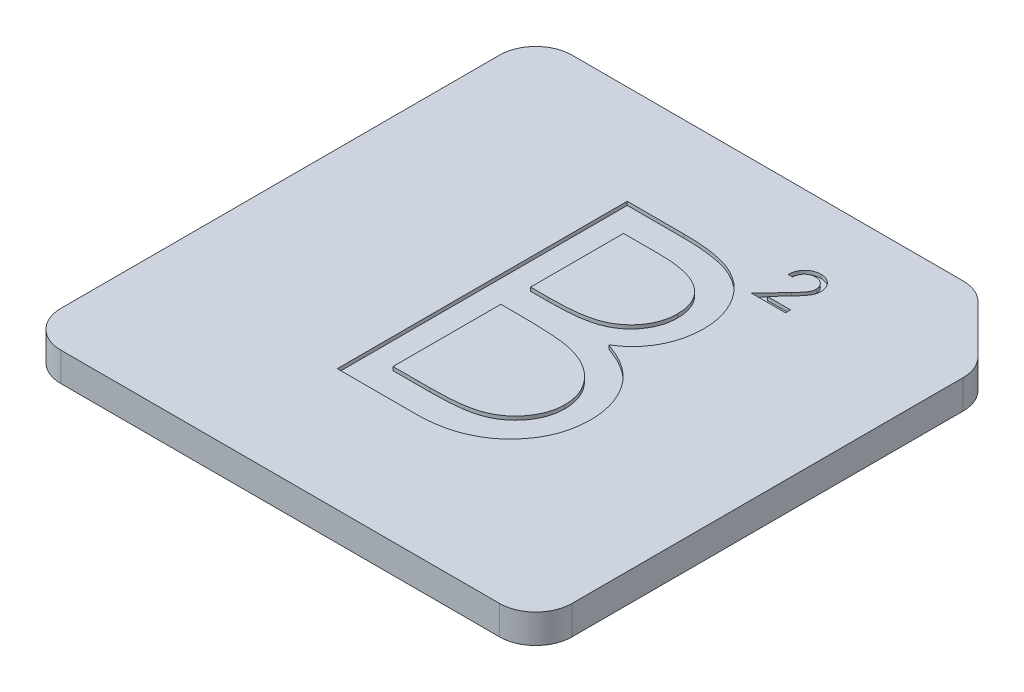
from build123d import *

# Parameters (mm, degrees)
BOSS_EXTRUDE1_DEPTH = 4
FILLET1_R           = 5
FILLET5_R           = 5
FILLET6_R           = 5
FILLET7_R           = 5
CUT_EXTRUDE1_DEPTH  = 0.5
CUT_EXTRUDE2_DEPTH  = 0.5
SKETCH5_R           = 3.25
CUT_EXTRUDE3_DEPTH  = 2.5


with BuildPart() as part:
    # Sketch1 → Boss-Extrude1 (new body)
    with BuildSketch(Plane(origin=(0, 0, 0), x_dir=(1, 0, 0), z_dir=(0, 1, 0))):
        Polygon((25.75, 35.25), (35.25, 25.75), (35.25, -35.25), (-35.25, -35.25), (-35.25, 35.25), align=None)
    extrude(amount=BOSS_EXTRUDE1_DEPTH)

    # Fillet1
    fillet1_edges = [part.edges().sort_by_distance(p)[0] for p in [
        (-35.25, 2, 35.25),
    ]]
    fillet(fillet1_edges, radius=FILLET1_R)

    # Fillet5
    fillet5_edges = [part.edges().sort_by_distance(p)[0] for p in [
        (35.25, 2, 35.25),
    ]]
    fillet(fillet5_edges, radius=FILLET5_R)

    # Fillet6
    fillet6_edges = [part.edges().sort_by_distance(p)[0] for p in [
        (-35.25, 2, -35.25),
    ]]
    fillet(fillet6_edges, radius=FILLET6_R)

    # Fillet7
    fillet7_edges = [part.edges().sort_by_distance(p)[0] for p in [
        (25.75, 2, -35.25),
        (35.25, 2, -25.75),
    ]]
    fillet(fillet7_edges, radius=FILLET7_R)

    # Sketch3 → Cut-Extrude1 (cut)
    with BuildSketch(Plane(origin=(0, 4, 0), x_dir=(1, 0, 0), z_dir=(0, 1, 0))):
        with BuildLine():
            Line((-8.984851083, 21.600223812), (-1.180363904, 21.600223812))
            add(Edge.make_bspline(
                [(-1.180363904, 21.600223812), (-0.798324153, 21.598215236), (-0.057836035, 21.594322116), (1.018957586, 21.533943474), (2.027515422, 21.451615818), (2.968129963, 21.320986188), (3.840366562, 21.163365878), (4.646853845, 20.97248798), (5.385027242, 20.743612395), (6.266315658, 20.379654895), (7.271123211, 19.838818685), (8.359104842, 19.039635084), (9.289439006, 18.062121219), (10.091568346, 16.9594623), (10.729295427, 15.746482052), (11.190658825, 14.452091323), (11.482748829, 13.092985701), (11.512788077, 12.159920811), (11.52796943, 11.688364838)],
                knots=[0, 0, 0, 0, 1.001505555, 1.941167018, 2.826882275, 3.653841531, 4.429895133, 5.150066043, 5.825578002, 6.45369114, 7.647487171, 8.808567382, 9.977351308, 11.170798116, 12.373658725, 13.556498008, 14.765093433, 16, 16, 16, 16], degree=3))
            add(Edge.make_bspline(
                [(11.52796943, 11.688364838), (11.515475505, 11.246621344), (11.490923764, 10.378553721), (11.256149371, 9.108906758), (10.888598875, 7.9003214), (10.377681741, 6.757208424), (9.713658928, 5.705395702), (8.926706714, 4.736398376), (7.977257543, 3.891243439), (7.265906229, 3.418753124), (6.904571994, 3.178749453)],
                knots=[0, 0, 0, 0, 1.044552857, 2.05264487, 3.044412934, 4.028983338, 5.005914585, 5.980388656, 6.974128949, 8, 8, 8, 8], degree=3))
            add(Edge.make_bspline(
                [(6.904571994, 3.178749453), (7.358976881, 3.004292322), (8.228365993, 2.670512615), (9.424777564, 2.080393026), (10.455575793, 1.438540336), (11.328686032, 0.737604906), (12.075402089, -0.01792436), (12.727435707, -0.839125666), (13.283794268, -1.73671147), (13.760513395, -2.701323303), (14.132499178, -3.723111513), (14.411080942, -4.792491811), (14.570708932, -5.905629585), (14.593424833, -6.663176777), (14.604892507, -7.045609521)],
                knots=[0, 0, 0, 0, 1.27268992, 2.434971085, 3.483601985, 4.442670788, 5.356604649, 6.2567628, 7.179492994, 8.113709626, 9.066344395, 10.018646069, 10.999752585, 12, 12, 12, 12], degree=3))
            add(Edge.make_bspline(
                [(14.604892507, -7.045609521), (14.593728552, -7.43608806), (14.571763159, -8.204365524), (14.409706338, -9.332995633), (14.135316544, -10.411566452), (13.757360585, -11.447054254), (13.26407699, -12.437455791), (12.663757398, -13.383893093), (11.947968099, -14.276856872), (11.147249597, -15.126269707), (10.241396506, -15.890015848), (9.264073592, -16.570195353), (8.202972793, -17.12957892), (7.075521433, -17.599476309), (5.869072106, -17.95841572), (4.589042308, -18.20953085), (3.236536001, -18.378731273), (2.30842456, -18.392642186), (1.832456609, -18.399776188)],
                knots=[0, 0, 0, 0, 0.978564426, 1.925352924, 2.850884081, 3.763762016, 4.682927383, 5.618979971, 6.567305752, 7.547517671, 8.540179244, 9.531824382, 10.526200242, 11.540722885, 12.589160233, 13.674978461, 14.80764778, 16, 16, 16, 16], degree=3))
            Line((1.832456609, -18.399776188), (-8.984851083, -18.399776188))
            Line((-8.984851083, -18.399776188), (-8.984851083, 21.600223812))
        make_face()
        with BuildLine():
            Line((-5.395107493, 17.497659709), (-5.395107493, 4.677146889))
            Line((-5.395107493, 4.677146889), (-2.983248519, 4.677146889))
            add(Edge.make_bspline(
                [(-2.983248519, 4.677146889), (-2.630690858, 4.681717437), (-1.949477609, 4.690548669), (-0.962964506, 4.715846007), (-0.047250012, 4.786680789), (0.796085223, 4.857495212), (1.565713154, 4.972633357), (2.259928714, 5.10968619), (2.889626965, 5.254633677), (3.6157932, 5.501142099), (4.439484039, 5.865458386), (5.317576658, 6.430850799), (6.091684882, 7.104271979), (6.745367027, 7.881311542), (7.280355262, 8.736925094), (7.651940578, 9.657460871), (7.90390954, 10.619976665), (7.926669898, 11.280756697), (7.93822584, 11.616249453)],
                knots=[0, 0, 0, 0, 1.156816544, 2.235205308, 3.236616184, 4.169592532, 5.011045266, 5.787822928, 6.49130361, 7.128639758, 8.301311294, 9.436451833, 10.541879658, 11.654887649, 12.756523258, 13.837046038, 14.901820046, 16, 16, 16, 16], degree=3))
            add(Edge.make_bspline(
                [(7.93822584, 11.616249453), (7.932212352, 11.83825827), (7.920416239, 12.273752809), (7.823807066, 12.90860257), (7.659606216, 13.505674028), (7.448700007, 14.073149574), (7.153972136, 14.593285005), (6.806961127, 15.084064385), (6.387696095, 15.52877431), (5.910469665, 15.94442572), (5.361799689, 16.312934609), (4.742013497, 16.635686188), (4.042725759, 16.895580778), (3.275721702, 17.12319395), (2.429194988, 17.283060165), (1.512914378, 17.416241738), (0.519374732, 17.484044504), (-0.167997869, 17.493020079), (-0.523312622, 17.497659709)],
                knots=[0, 0, 0, 0, 0.91205012, 1.789085906, 2.630437955, 3.453916878, 4.269457761, 5.079663411, 5.91843418, 6.774407191, 7.675494373, 8.627863946, 9.638891023, 10.736472738, 11.911756761, 13.175263542, 14.539845004, 16, 16, 16, 16], degree=3))
            Line((-0.523312622, 17.497659709), (-5.395107493, 17.497659709))
        make_face(mode=Mode.SUBTRACT)
        with BuildLine():
            Line((-5.395107493, 0.574582786), (-5.395107493, -14.297212086))
            Line((-5.395107493, -14.297212086), (-0.282928006, -14.297212086))
            add(Edge.make_bspline(
                [(-0.282928006, -14.297212086), (0.083002576, -14.292826401), (0.788285531, -14.284373572), (1.806585304, -14.256778663), (2.750392204, -14.194009798), (3.61539947, -14.095200087), (4.4109475, -13.988017811), (5.127492677, -13.843888886), (5.77084346, -13.678757909), (6.516835548, -13.423510226), (7.356875643, -13.02697913), (8.262142573, -12.429102257), (9.067013637, -11.716835882), (9.750502314, -10.892482577), (10.310650754, -9.996124555), (10.71814167, -9.045891984), (10.969465746, -8.057485957), (10.999890538, -7.383580671), (11.015148917, -7.045609521)],
                knots=[0, 0, 0, 0, 1.160039823, 2.235823828, 3.228722157, 4.157150951, 4.99529583, 5.772374946, 6.472645482, 7.099169577, 8.269452708, 9.405989375, 10.527446681, 11.663510218, 12.788923519, 13.866172445, 14.929861265, 16, 16, 16, 16], degree=3))
            add(Edge.make_bspline(
                [(11.015148917, -7.045609521), (11.011993439, -6.834257058), (11.005733381, -6.414961267), (10.911326353, -5.798780476), (10.774024984, -5.201913352), (10.596522882, -4.622739175), (10.338014687, -4.07172916), (10.036225601, -3.537985622), (9.682381011, -3.020803), (9.131019115, -2.366948675), (8.329053578, -1.613611385), (7.189547573, -0.87603993), (5.893864167, -0.281207849), (4.954121391, -0.028642406), (4.468674558, 0.101826376)],
                knots=[0, 0, 0, 0, 0.723448775, 1.435228256, 2.130040452, 2.821711965, 3.505591119, 4.210454504, 4.921174351, 5.648778258, 7.137944449, 8.670945889, 10.280296675, 12, 12, 12, 12], degree=3))
            add(Edge.make_bspline(
                [(4.468674558, 0.101826376), (4.27405632, 0.14131305), (3.852083836, 0.226928303), (3.163997202, 0.317302056), (2.378444415, 0.397817027), (1.493611532, 0.457373114), (0.508379062, 0.518933612), (-0.579357151, 0.542874425), (-1.765155033, 0.571437397), (-2.587925004, 0.573507503), (-3.015299801, 0.574582786)],
                knots=[0, 0, 0, 0, 0.634451884, 1.375622551, 2.216452059, 3.157844607, 4.20941857, 5.370758133, 6.634282058, 8, 8, 8, 8], degree=3))
            Line((-3.015299801, 0.574582786), (-5.395107493, 0.574582786))
        make_face(mode=Mode.SUBTRACT)
    extrude(amount=-CUT_EXTRUDE1_DEPTH, mode=Mode.SUBTRACT)

    # Sketch4 → Cut-Extrude2 (cut)
    with BuildSketch(Plane(origin=(0, 4, 0), x_dir=(1, 0, 0), z_dir=(0, 1, 0))):
        with BuildLine():
            Line((11.463046089, 23.949295738), (10.845684978, 23.949295738))
            add(Edge.make_bspline(
                [(10.845684978, 23.949295738), (10.849708609, 24.031198876), (10.857610912, 24.192054458), (10.894617466, 24.426582755), (10.947569119, 24.650754747), (11.022436965, 24.862770494), (11.115416327, 25.064504626), (11.226917845, 25.255155847), (11.358985759, 25.433996862), (11.50876828, 25.599369756), (11.671448069, 25.751080088), (11.846976767, 25.882089381), (12.031426934, 25.992780423), (12.224238967, 26.085317483), (12.427588241, 26.154777109), (12.63962943, 26.206315117), (12.861294137, 26.237323149), (13.012321371, 26.240656175), (13.089131159, 26.242351293)],
                knots=[0, 0, 0, 0, 1.10065271, 2.161652631, 3.183658789, 4.190468796, 5.17591951, 6.163126047, 7.15150782, 8.156236427, 9.156009102, 10.134482811, 11.092018607, 12.041330605, 13.001268258, 13.972401359, 14.968799086, 16, 16, 16, 16], degree=3))
            add(Edge.make_bspline(
                [(13.089131159, 26.242351293), (13.164562349, 26.240585399), (13.312781945, 26.237115479), (13.529106214, 26.207316837), (13.735043491, 26.160645442), (13.930191232, 26.095164784), (14.112992438, 26.007142058), (14.284820351, 25.901404277), (14.447720611, 25.77911268), (14.594358468, 25.635134054), (14.729009466, 25.481429129), (14.845173542, 25.317335642), (14.944652509, 25.147854034), (15.02757139, 24.971691938), (15.088611491, 24.787190667), (15.134953898, 24.597036343), (15.161148612, 24.399260673), (15.165168843, 24.265398859), (15.167212756, 24.197342613)],
                knots=[0, 0, 0, 0, 1.111607364, 2.184268762, 3.212621178, 4.221274766, 5.211760367, 6.196651075, 7.1921475, 8.207485113, 9.220403448, 10.201281604, 11.166441695, 12.114753415, 13.065576456, 14.026450734, 14.996634279, 16, 16, 16, 16], degree=3))
            add(Edge.make_bspline(
                [(15.167212756, 24.197342613), (15.163884688, 24.101529905), (15.157286955, 23.911585866), (15.100849532, 23.632459034), (15.012704782, 23.362022445), (14.906574263, 23.144370914), (14.799509971, 22.968984607), (14.703029643, 22.824583617), (14.590083926, 22.669103702), (14.459028925, 22.503065507), (14.312575649, 22.325168478), (14.149397564, 22.135520082), (13.968331053, 21.936079735), (13.84124631, 21.799861226), (13.775394179, 21.729276207)],
                knots=[0, 0, 0, 0, 1.184426356, 2.348067706, 3.509069118, 4.696110526, 5.333549288, 6.050745305, 6.844228056, 7.710549037, 8.667450064, 9.695053472, 10.805634456, 12, 12, 12, 12], degree=3))
            Line((13.775394179, 21.729276207), (12.054224475, 19.892351293))
            Line((12.054224475, 19.892351293), (15.2554072, 19.892351293))
            Line((15.2554072, 19.892351293), (15.2554072, 19.186795738))
            Line((15.2554072, 19.186795738), (10.581101645, 19.186795738))
            Line((10.581101645, 19.186795738), (13.248983589, 22.033822648))
            add(Edge.make_bspline(
                [(13.248983589, 22.033822648), (13.313938424, 22.101628248), (13.438703368, 22.231868929), (13.615168885, 22.422014914), (13.773662896, 22.598415499), (13.915211367, 22.760737394), (14.03674365, 22.911354916), (14.144593715, 23.045389982), (14.231007037, 23.16873236), (14.324790512, 23.311702304), (14.415622992, 23.486260799), (14.493676682, 23.699581181), (14.54127039, 23.919178436), (14.546979775, 24.067575893), (14.549851645, 24.142221085)],
                knots=[0, 0, 0, 0, 1.329631726, 2.553950428, 3.673215718, 4.687767853, 5.603093632, 6.413772471, 7.123043292, 7.734684054, 8.834405432, 9.900288307, 10.943827018, 12, 12, 12, 12], degree=3))
            add(Edge.make_bspline(
                [(14.549851645, 24.142221085), (14.548602108, 24.189159405), (14.546139512, 24.28166582), (14.524405871, 24.417294997), (14.491561769, 24.548126553), (14.444497935, 24.674562923), (14.382375639, 24.795332889), (14.306757127, 24.91058346), (14.219509515, 25.022004271), (14.118579817, 25.126475813), (14.007704318, 25.222157563), (13.89057324, 25.306916926), (13.766649761, 25.377750941), (13.636456378, 25.435817981), (13.500356056, 25.481368641), (13.358085563, 25.512931396), (13.210038003, 25.532748279), (13.108946692, 25.535429526), (13.05743628, 25.536795738)],
                knots=[0, 0, 0, 0, 0.991446411, 1.95395049, 2.89581595, 3.838931463, 4.798493298, 5.75982156, 6.748411868, 7.785213223, 8.824556874, 9.840280684, 10.836137867, 11.835679398, 12.848801643, 13.863922112, 14.911575587, 16, 16, 16, 16], degree=3))
            add(Edge.make_bspline(
                [(13.05743628, 25.536795738), (13.00363956, 25.535390359), (12.897991684, 25.532630427), (12.742878204, 25.513324215), (12.594905801, 25.480017569), (12.453702251, 25.434464367), (12.319028637, 25.376564291), (12.191539903, 25.30444754), (12.071522248, 25.218392127), (11.958750057, 25.120824795), (11.854847165, 25.012197641), (11.763556936, 24.891104726), (11.683790023, 24.759757032), (11.614194017, 24.618508969), (11.557675393, 24.466078861), (11.514487689, 24.303007812), (11.480314256, 24.130003883), (11.468897747, 24.010532246), (11.463046089, 23.949295738)],
                knots=[0, 0, 0, 0, 1.031018746, 2.02475058, 2.990194455, 3.934040569, 4.864654155, 5.795059489, 6.735614925, 7.690564532, 8.649604399, 9.611025574, 10.590972636, 11.591080095, 12.624614302, 13.701020113, 14.821632451, 16, 16, 16, 16], degree=3))
        make_face()
    extrude(amount=-CUT_EXTRUDE2_DEPTH, mode=Mode.SUBTRACT)

    # Sketch5 → Cut-Extrude3 (cut)
    with BuildSketch(Plane.XZ):
        with Locations(Location((-30.5, -30.5, 0), (0, 0, 270))):
            Circle(SKETCH5_R)
        with Locations(Location((-30.5, 30.5, 0), (0, 0, 270))):
            Circle(SKETCH5_R)
        with Locations(Location((30.5, 30.5, 0), (0, 0, 270))):
            Circle(SKETCH5_R)
    extrude(amount=-CUT_EXTRUDE3_DEPTH, mode=Mode.SUBTRACT)


solid = part.part
